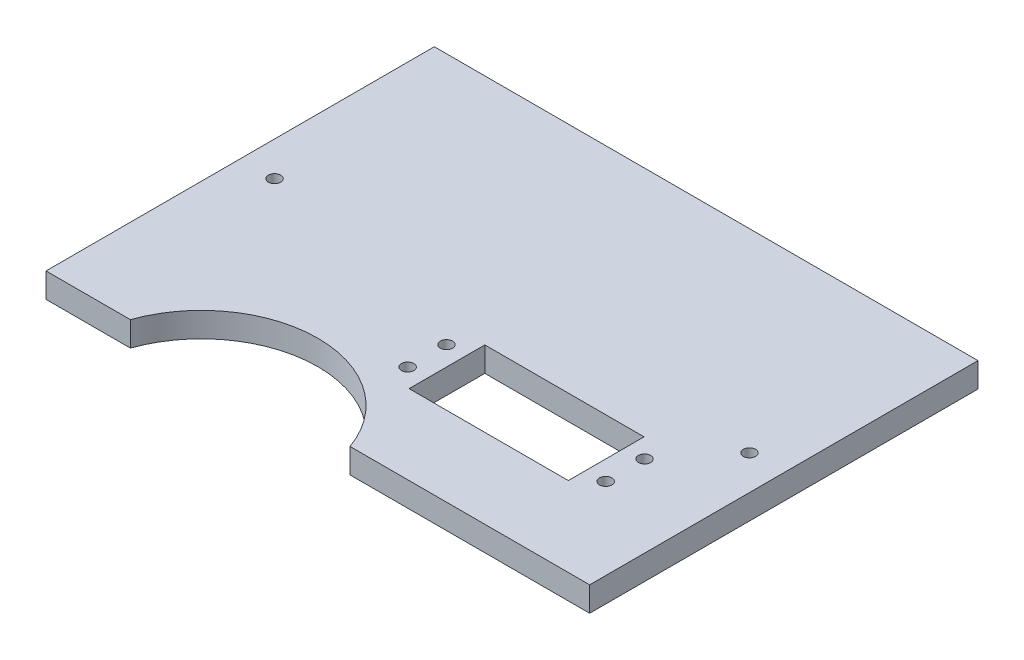
from build123d import *

# Parameters (mm, degrees)
SKETCH1_W           = 140
SKETCH1_H           = 100
BOSS_EXTRUDE1_DEPTH = 6.35
SKETCH2_W           = 41
SKETCH2_H           = 19.5
CUT_EXTRUDE1_DEPTH  = 10
SKETCH3_R           = 30
CUT_EXTRUDE2_DEPTH  = 10
SKETCH4_R           = 1.5875
CUT_EXTRUDE3_DEPTH  = 10


with BuildPart() as part:
    # Sketch1 → Boss-Extrude1 (new body)
    with BuildSketch(Plane(origin=(0, 0, 0), x_dir=(1, 0, 0), z_dir=(0, 1, 0))):
        with Locations((70, 50)):
            Rectangle(SKETCH1_W, SKETCH1_H)
    extrude(amount=BOSS_EXTRUDE1_DEPTH)

    # Sketch2 → Cut-Extrude1 (cut)
    with BuildSketch(Plane(origin=(0, 6.35, 0), x_dir=(1, 0, 0), z_dir=(0, 1, 0))):
        with Locations((93.5, 30.25)):
            Rectangle(SKETCH2_W, SKETCH2_H)
    extrude(amount=-CUT_EXTRUDE1_DEPTH, mode=Mode.SUBTRACT)

    # Sketch3 → Cut-Extrude2 (cut)
    with BuildSketch(Plane(origin=(0, 6.35, 0), x_dir=(1, 0, 0), z_dir=(0, 1, 0))):
        with Locations((50, -10)):
            Circle(SKETCH3_R)
    extrude(amount=-CUT_EXTRUDE2_DEPTH, mode=Mode.SUBTRACT)

    # Sketch4 → Cut-Extrude3 (cut)
    with BuildSketch(Plane(origin=(0, 6.35, 0), x_dir=(1, 0, 0), z_dir=(0, 1, 0))):
        with Locations(Location((131.15, 50, 0), (0, 0, 270))):
            Circle(SKETCH4_R)
        with Locations(Location((8.85, 50, 0), (0, 0, 270))):
            Circle(SKETCH4_R)
        with Locations(Location((68, 25.125, 0), (0, 0, 270))):
            Circle(SKETCH4_R)
        with Locations(Location((119, 35.125, 0), (0, 0, 270))):
            Circle(SKETCH4_R)
        with Locations(Location((68, 35.125, 0), (0, 0, 270))):
            Circle(SKETCH4_R)
        with Locations(Location((119, 25.125, 0), (0, 0, 270))):
            Circle(SKETCH4_R)
    extrude(amount=-CUT_EXTRUDE3_DEPTH, mode=Mode.SUBTRACT)


solid = part.part
